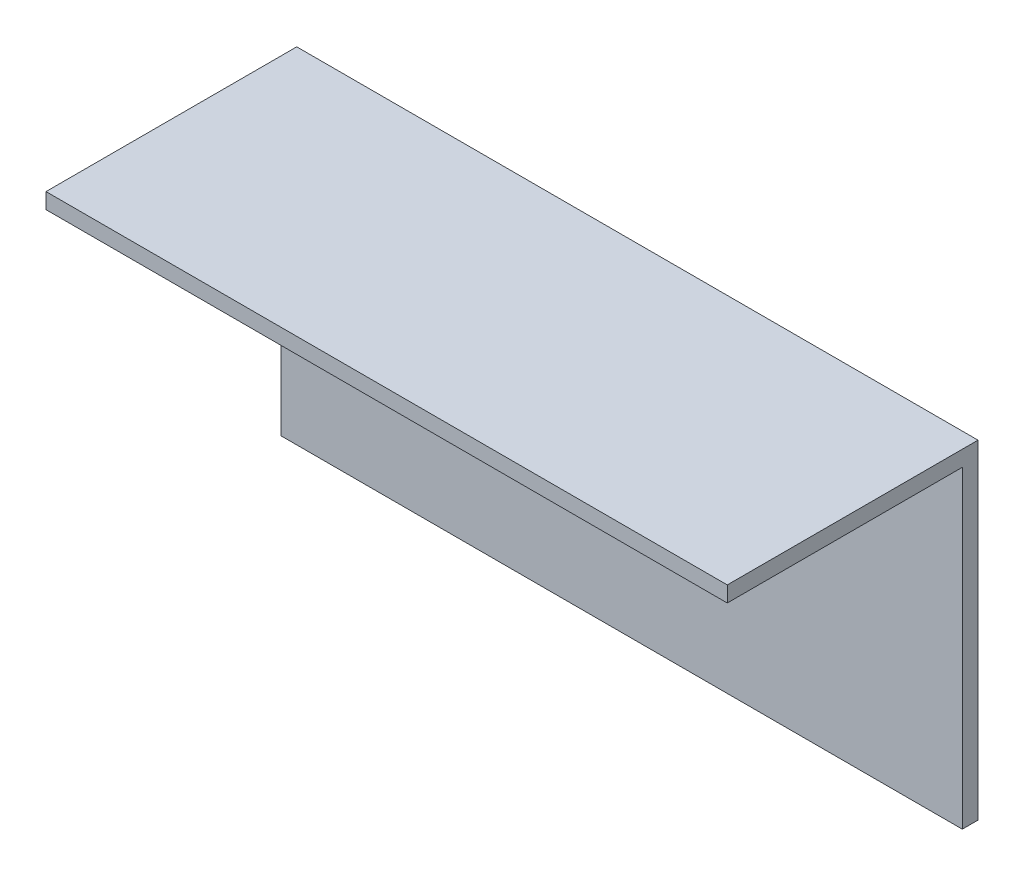
from build123d import *

# Parameters (mm, degrees)
CROQUIS1_W              = 434.74
CROQUIS1_H              = 210
SALIENTE_EXTRUIR1_DEPTH = 10
CROQUIS2_W              = 434.74
CROQUIS2_H              = 10
SALIENTE_EXTRUIR2_DEPTH = 150


with BuildPart() as part:
    # Croquis1 → Saliente-Extruir1 (new body)
    with BuildSketch(Plane.XY):
        Rectangle(CROQUIS1_W, CROQUIS1_H)
    extrude(amount=SALIENTE_EXTRUIR1_DEPTH)

    # Croquis2 → Saliente-Extruir2 (add)
    with BuildSketch(Plane.XY.offset(10)):
        with Locations((0, 100)):
            Rectangle(CROQUIS2_W, CROQUIS2_H)
    extrude(amount=SALIENTE_EXTRUIR2_DEPTH)


solid = part.part
